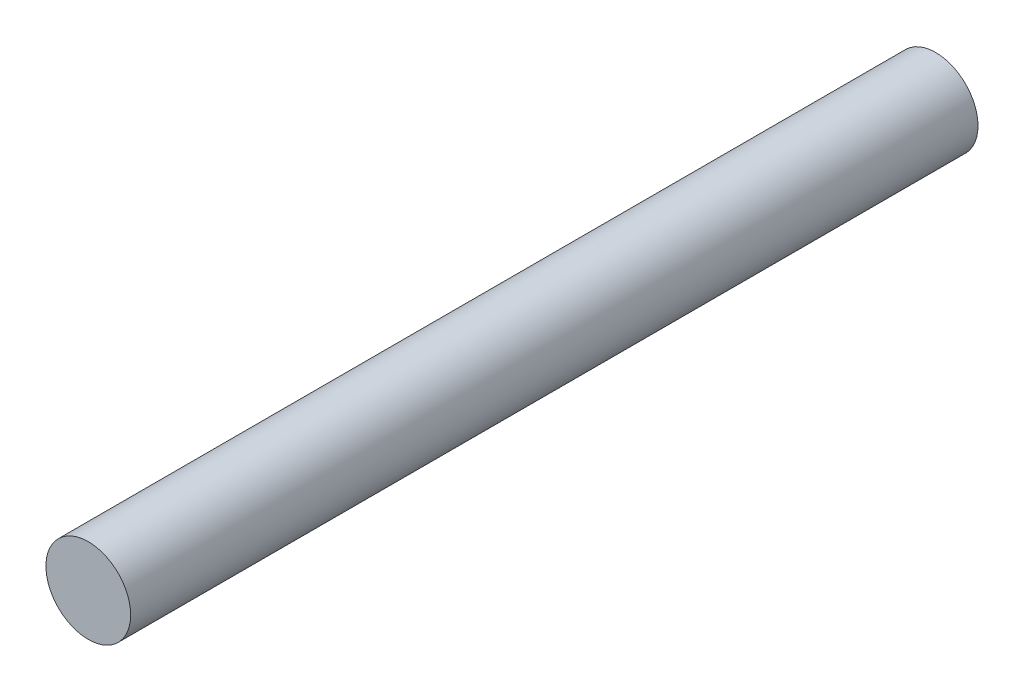
from build123d import *

# Parameters (mm, degrees)
SKETCH_1_R      = 0.5
EXTRUDE_1_DEPTH = 10


with BuildPart() as part:
    # 草图1 → 凸台-拉伸1 (new body)
    with BuildSketch(Plane.XY):
        Circle(SKETCH_1_R)
    extrude(amount=EXTRUDE_1_DEPTH)


solid = part.part
